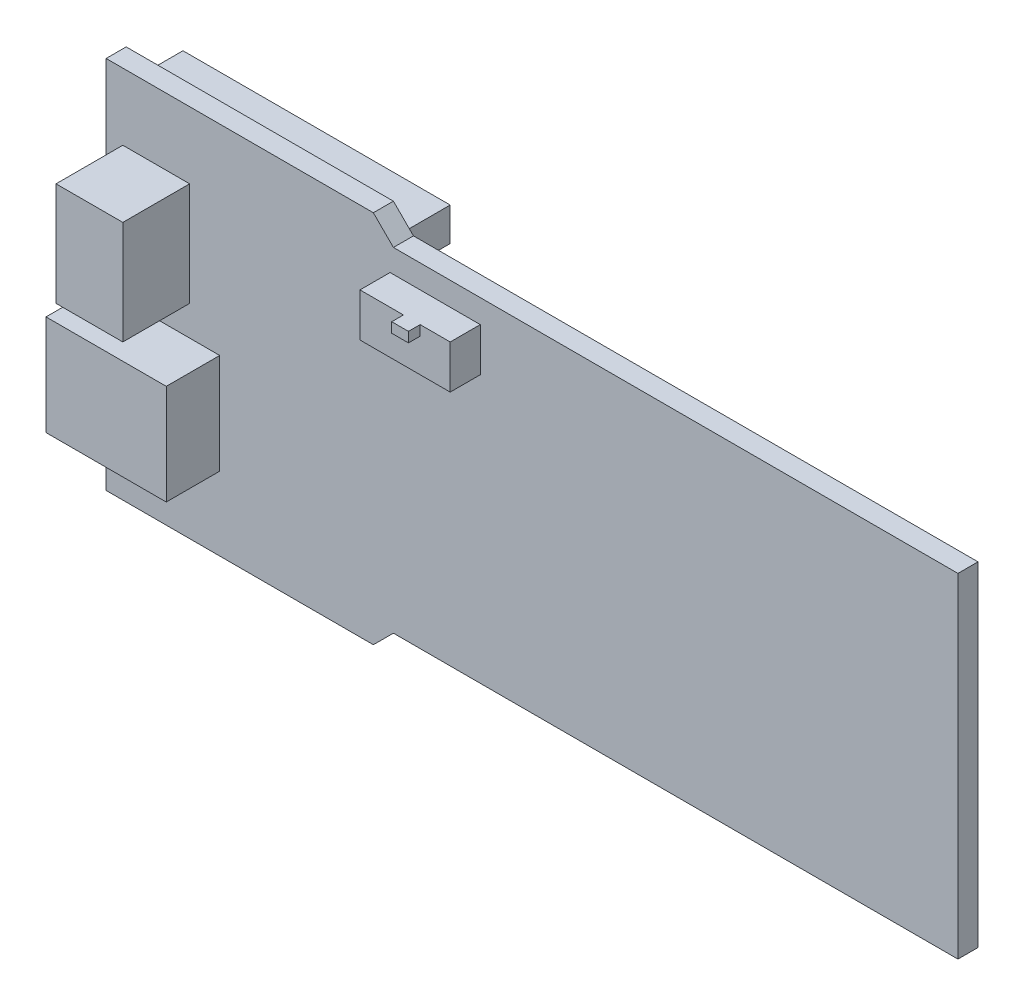
from build123d import *

# Parameters (mm, degrees)
BOSS_EXTRUDE1_DEPTH = 1.524
SKETCH2_W           = 9.144
SKETCH2_H           = 7.62
BOSS_EXTRUDE2_DEPTH = 4.064
SKETCH3_W           = 5.08
SKETCH3_H           = 7.874
BOSS_EXTRUDE3_DEPTH = 5.08
SKETCH4_W           = 20.32
SKETCH4_H           = 2.54
BOSS_EXTRUDE4_DEPTH = 3.81
SKETCH6_W           = 6.858
SKETCH6_H           = 3.302
BOSS_EXTRUDE5_DEPTH = 2.286
SKETCH7_W           = 1.27
SKETCH7_H           = 0.762
BOSS_EXTRUDE6_DEPTH = 0.889


with BuildPart() as part:
    # Sketch1 → Boss-Extrude1 (new body)
    with BuildSketch(Plane.XY):
        Polygon((-10.536438109, -12.7), (32.389561792, -12.7), (32.389561792, 12.7), (-10.536438109, 12.7), (-12.060438109, 14.224), (-32.380438109, 14.224), (-32.380438109, -14.224), (-12.060438109, -14.224), align=None)
    extrude(amount=BOSS_EXTRUDE1_DEPTH)

    # Sketch2 → Boss-Extrude2 (add)
    with BuildSketch(Plane.XY.offset(1.524)):
        with Locations((-28.316438109, -4.826)):
            Rectangle(SKETCH2_W, SKETCH2_H)
    extrude(amount=BOSS_EXTRUDE2_DEPTH)

    # Sketch3 → Boss-Extrude3 (add)
    with BuildSketch(Plane.XY.offset(1.524)):
        with Locations((-28.570438109, 5.207)):
            Rectangle(SKETCH3_W, SKETCH3_H)
    extrude(amount=BOSS_EXTRUDE3_DEPTH)

    # Sketch4 → Boss-Extrude4 (add)
    with BuildSketch(Plane(origin=(0, 0, 0), x_dir=(-1, 0, 0), z_dir=(0, 0, -1))):
        with Locations((21.712438109, 11.049)):
            Rectangle(SKETCH4_W, SKETCH4_H)
    boss_extrude4 = extrude(amount=BOSS_EXTRUDE4_DEPTH)

    # Mirror1: Boss-Extrude4 across plane
    add(boss_extrude4.mirror(Plane.ZX))

    # Sketch6 → Boss-Extrude5 (add)
    with BuildSketch(Plane.XY.offset(1.524)):
        with Locations((-7.361438109, 9.271)):
            Rectangle(SKETCH6_W, SKETCH6_H)
    extrude(amount=BOSS_EXTRUDE5_DEPTH)

    # Sketch7 → Boss-Extrude6 (add)
    with BuildSketch(Plane.XY.offset(3.81)):
        with Locations((-6.853438109, 10.541)):
            Rectangle(SKETCH7_W, SKETCH7_H)
    extrude(amount=BOSS_EXTRUDE6_DEPTH)


solid = part.part
